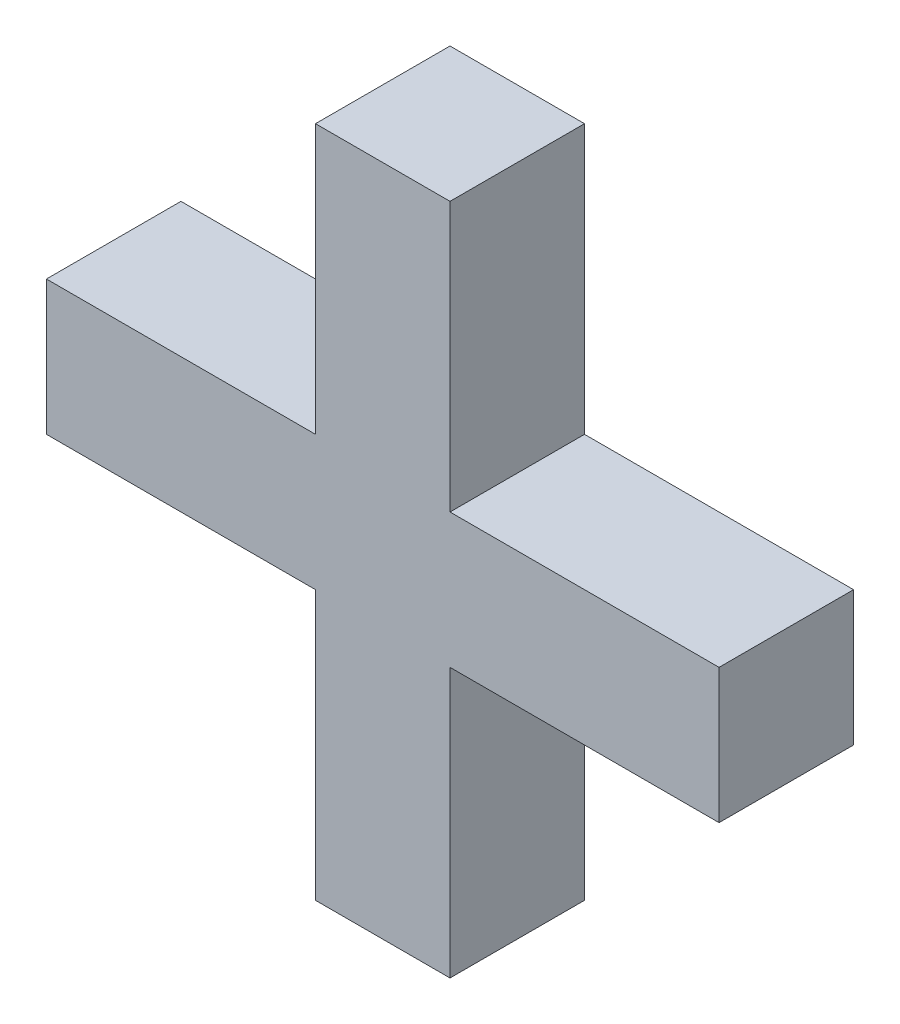
from build123d import *

# Parameters (mm, degrees)
SKETCH1_W                = 1
SKETCH1_H                = 5
BOSS_EXTRUDE1_DEPTH      = 1
SKETCH2_R                = 0.228902054
BOSS_EXTRUDE2_DEPTH      = 0.01
BOSS_EXTRUDE3_DEPTH      = 2
BOSS_EXTRUDE3_DEPTH_BACK = 3


with BuildPart() as part:
    # Sketch1 → Boss-Extrude1 (new body)
    with BuildSketch(Plane.XY):
        with Locations((0.5, -2.5)):
            Rectangle(SKETCH1_W, SKETCH1_H)
    extrude(amount=BOSS_EXTRUDE1_DEPTH)

    # Sketch2 → Boss-Extrude2 (add)
    with BuildSketch(Plane(origin=(1, 0, 0), x_dir=(0, 0, -1), z_dir=(1, 0, 0))):
        with Locations(Location((-0.5, -2.5, 0), (0, 0, 270))):
            Circle(SKETCH2_R)
    extrude(amount=BOSS_EXTRUDE2_DEPTH)

    # Sketch3 → Boss-Extrude3 (add, two sides: drawn at the far end of the back side and taken through both)
    with BuildSketch(Plane.ZY.offset(-BOSS_EXTRUDE3_DEPTH_BACK)):
        Polygon((0.6, -2), (0.4, -3), (1, -3), (1, -2), align=None)
        Polygon((0, -3), (0.4, -3), (0.6, -2), (0, -2), align=None)
    extrude(amount=BOSS_EXTRUDE3_DEPTH + BOSS_EXTRUDE3_DEPTH_BACK)


solid = part.part
